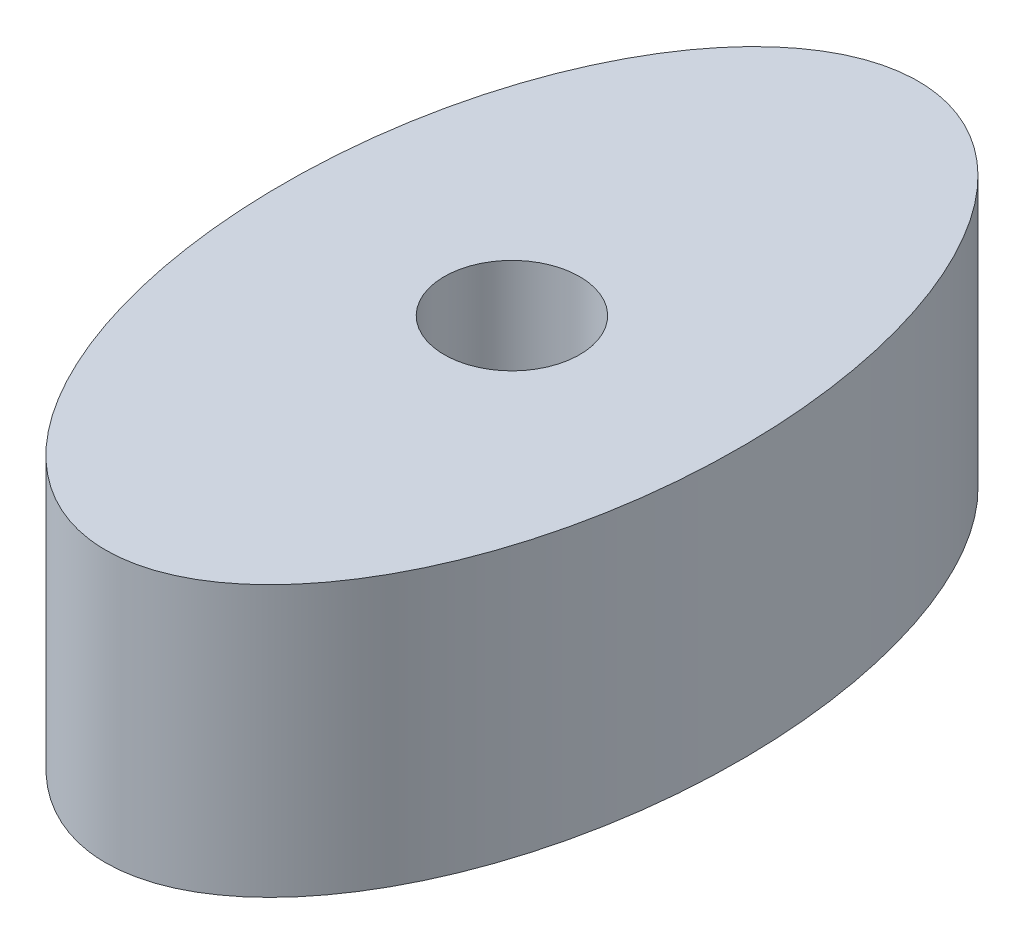
from build123d import *

# Parameters (mm, degrees)
SKETCH_1_RX         = 24
SKETCH_1_RY         = 13.5
EXTRUDE_1_DEPTH     = 16
SKETCH_2_R          = 4
CUT_EXTRUDE_1_DEPTH = 32.847291879


with BuildPart() as part:
    # 草图1 → 凸台-拉伸1 (new body)
    with BuildSketch(Plane(origin=(0, 0, 0), x_dir=(1, 0, 0), z_dir=(0, 1, 0))):
        with Locations(Location((0, 0), (0, 0, -90))):
            Ellipse(SKETCH_1_RX, SKETCH_1_RY)
    extrude(amount=EXTRUDE_1_DEPTH)

    # 草图2 → 切除-拉伸1 (cut, through all)
    with BuildSketch(Plane.XZ):
        with Locations(Location((0, 0, 0), (0, 0, 270))):
            Circle(SKETCH_2_R)
    extrude(amount=-CUT_EXTRUDE_1_DEPTH, mode=Mode.SUBTRACT)


solid = part.part
